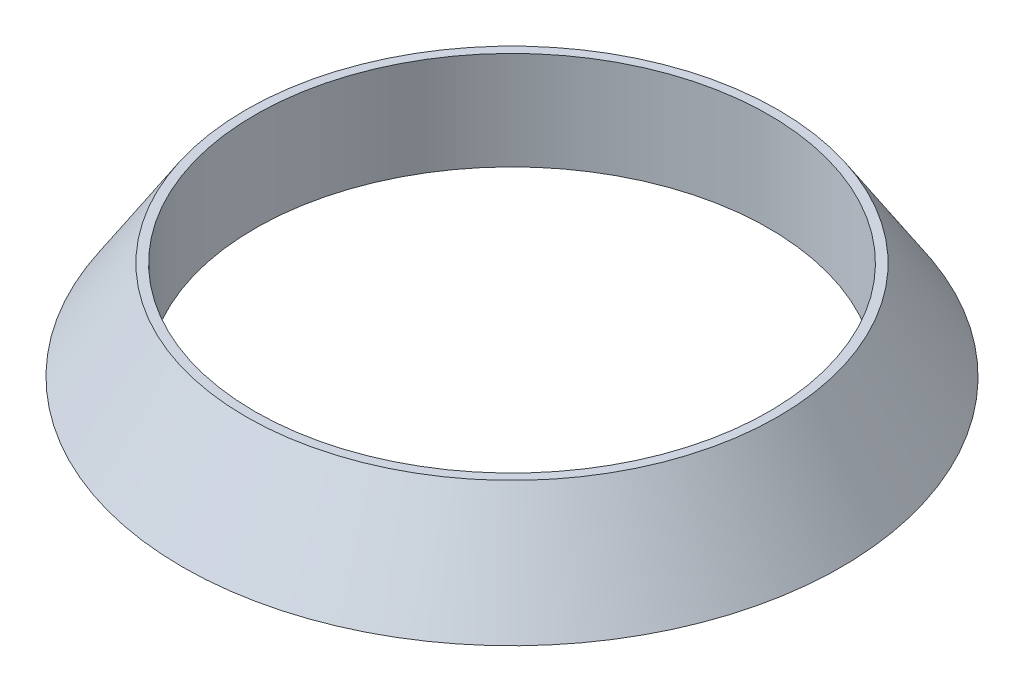
from build123d import *

# Parameters (mm, degrees)
SKETCH2_R           = 85.16650342
SKETCH2_R_2         = 66.416308437
BOSS_EXTRUDE1_DEPTH = 25.4


with BuildPart() as part:
    # Sketch2 → Boss-Extrude1 (new body)
    with BuildSketch(Plane(origin=(0, 0, 0), x_dir=(1, 0, 0), z_dir=(0, 1, 0))):
        with Locations(Location((0, 0, 0), (0, 0, 270))):
            Circle(SKETCH2_R)
        with Locations(Location((0, 0, 0), (0, 0, 270))):
            Circle(SKETCH2_R_2, mode=Mode.SUBTRACT)
    extrude(amount=BOSS_EXTRUDE1_DEPTH)

    # Sketch5 → Cut-Revolve2 (revolve, cut)
    with BuildSketch(Plane(origin=(0, 0, 0), x_dir=(0, 0, -1), z_dir=(1, 0, 0)), mode=Mode.PRIVATE) as cut_revolve2_sk:
        Polygon((-85.16650342, 0), (-68.732311403, 25.4), (-85.16650342, 25.4), align=None)
    revolve(cut_revolve2_sk.sketch.rotate(Axis((0, 0, 0), (0, 1, 0)), 180), axis=Axis((0, 0, 0), (0, 1, 0)), mode=Mode.SUBTRACT)


solid = part.part
